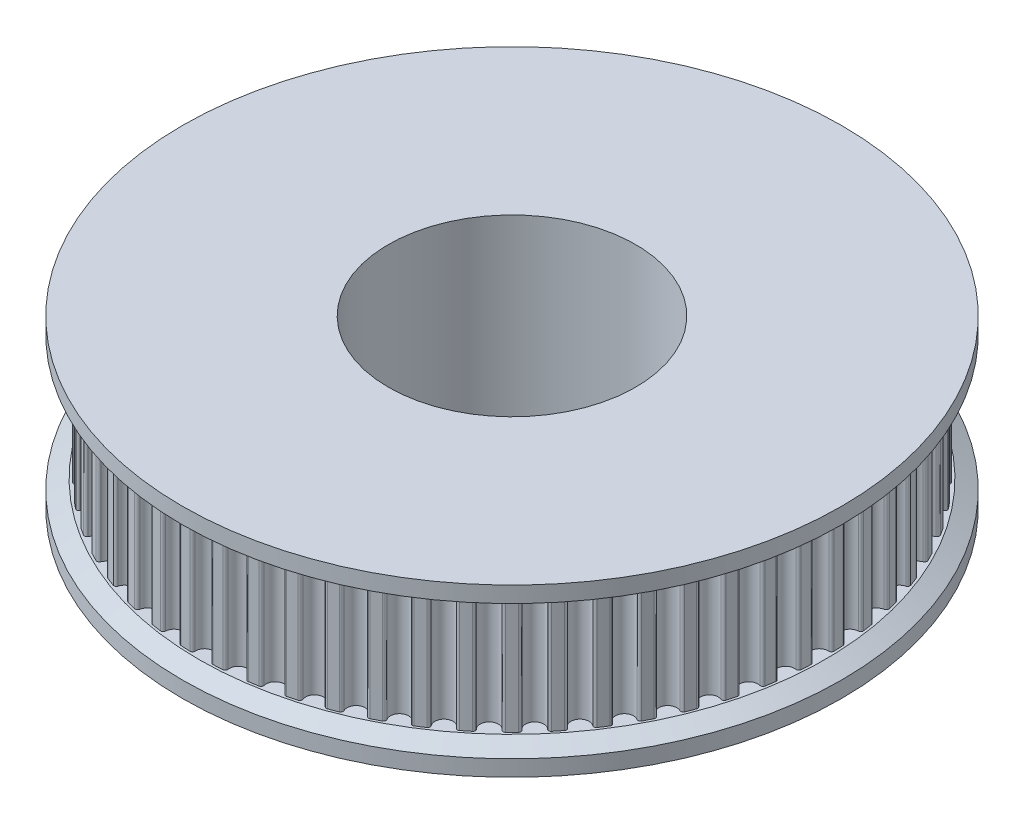
from build123d import *
from OCP.BRepFilletAPI import BRepFilletAPI_MakeChamfer

# Parameters (mm, degrees)
SKETCH_1_R               = 10
SKETCH_1_R_2             = 7.5
EXTRUDE_1_DEPTH          = 7.45
SKETCH_2_R               = 7.5
EXTRUDE_2_DEPTH          = 7
SKETCH_3_R               = 20
SKETCH_3_R_2             = 7.5
EXTRUDE_3_DEPTH          = 1.55
CUT_EXTRUDE_1_REACH      = 34.496
CUT_EXTRUDE_1_END_RADIUS = 10
SKETCH_4_R               = 1.5
EXTRUDE_START            = 1.55
SKETCH_7_R               = 20
SKETCH_7_R_2             = 7.5
EXTRUDE_4_DEPTH          = 1.55
CUT_EXTRUDE_2_REACH      = 34.496
CUT_EXTRUDE_2_END_RADIUS = 10
SKETCH_5_R               = 1.5
CHAMFER_1_SIZE           = 1
CHAMFER_1_SIZE2          = 0.577350269


with BuildPart() as part:
    # Эскиз1 → Бобышка-Вытянуть1 (new body)
    with BuildSketch(Plane(origin=(0, 0, 0), x_dir=(1, 0, 0), z_dir=(0, 1, 0))):
        with Locations(Location((0, 0, 0), (0, 0, 270))):
            Circle(SKETCH_1_R)
        with Locations(Location((0, 0, 0), (0, 0, 270))):
            Circle(SKETCH_1_R_2, mode=Mode.SUBTRACT)
    extrude(amount=EXTRUDE_1_DEPTH)

    # Эскиз2 → Бобышка-Вытянуть2 (add)
    with BuildSketch(Plane(origin=(0, 7.45, 0), x_dir=(1, 0, 0), z_dir=(0, 1, 0))):
        with BuildLine():
            ThreePointArc((1.268212169, 18.807289488), (0.986532775, 18.82416673), (0.704632299, 18.836825458))
            ThreePointArc((0.704632299, 18.836825458), (0.592145975, 18.792176877), (0.549234042, 18.67901666))
            ThreePointArc((0.549234042, 18.67901666), (0, 18.1), (-0.549234042, 18.67901666))
            ThreePointArc((-0.549234042, 18.67901666), (-0.592145975, 18.792176877), (-0.704632299, 18.836825458))
            ThreePointArc((-0.704632299, 18.836825458), (-0.986532775, 18.82416673), (-1.268212169, 18.807289488))
            ThreePointArc((-1.268212169, 18.807289488), (-1.375415233, 18.751127475), (-1.406263626, 18.634101643))
            ThreePointArc((-1.406263626, 18.634101643), (-1.891965185, 18.000846306), (-2.498714188, 18.519280462))
            ThreePointArc((-2.498714188, 18.519280462), (-2.553219508, 18.627335257), (-2.669756667, 18.659981226))
            ThreePointArc((-2.669756667, 18.659981226), (-2.948789666, 18.61792522), (-3.227161838, 18.571696919))
            ThreePointArc((-3.227161838, 18.571696919), (-3.327907104, 18.504636796), (-3.346353976, 18.385027509))
            ThreePointArc((-3.346353976, 18.385027509), (-3.763201604, 17.704471573), (-4.420817898, 18.156643152))
            ThreePointArc((-4.420817898, 18.156643152), (-4.486319434, 18.258408654), (-4.605630623, 18.278694334))
            ThreePointArc((-4.605630623, 18.278694334), (-4.878739, 18.207701826), (-5.150754047, 18.132628953))
            ThreePointArc((-5.150754047, 18.132628953), (-5.243937728, 18.055405444), (-5.249780971, 17.934523166))
            ThreePointArc((-5.249780971, 17.934523166), (-5.593207598, 17.214122945), (-6.294486201, 17.59507786))
            ThreePointArc((-6.294486201, 17.59507786), (-6.370266305, 17.689439105), (-6.491044326, 17.697142243))
            ThreePointArc((-6.491044326, 17.697142243), (-6.755235849, 17.597991039), (-7.017913517, 17.494896109))
            ThreePointArc((-7.017913517, 17.494896109), (-7.102514673, 17.408355292), (-7.095690268, 17.287524434))
            ThreePointArc((-7.095690268, 17.287524434), (-7.36193324, 16.535172783), (-8.099190797, 16.840737213))
            ThreePointArc((-8.099190797, 16.840737213), (-8.184419205, 16.926660359), (-8.305340789, 16.921696558))
            ThreePointArc((-8.305340789, 16.921696558), (-8.55772092, 16.795472981), (-8.808183258, 16.665485522))
            ThreePointArc((-8.808183258, 16.665485522), (-8.883274981, 16.570575556), (-8.863857697, 16.451119967))
            ThreePointArc((-8.863857697, 16.451119967), (-9.05, 15.675059808), (-9.815158964, 15.901885924))
            ThreePointArc((-9.815158964, 15.901885924), (-9.908901896, 15.97842958), (-10.0286422, 15.960853224))
            ThreePointArc((-10.0286422, 15.960853224), (-10.26644581, 15.808940206), (-10.5019487, 15.653484389))
            ThreePointArc((-10.5019487, 15.653484389), (-10.56670827, 15.551245126), (-10.534910846, 15.434473587))
            ThreePointArc((-10.534910846, 15.434473587), (-10.638913066, 14.643207598), (-11.423590195, 14.788810246))
            ThreePointArc((-11.423590195, 14.788810246), (-11.524820584, 14.855135783), (-11.642067708, 14.825139442))
            ThreePointArc((-11.642067708, 14.825139442), (-11.862689371, 14.649201373), (-12.080652594, 14.469980405))
            ThreePointArc((-12.080652594, 14.469980405), (-12.134370491, 14.361532001), (-12.090541307, 14.248723884))
            ThreePointArc((-12.090541307, 14.248723884), (-12.111263975, 13.450921341), (-12.906862181, 13.513705268))
            ThreePointArc((-12.906862181, 13.513705268), (-13.014470926, 13.56908601), (-13.127940287, 13.52699833))
            ThreePointArc((-13.127940287, 13.52699833), (-13.328962825, 13.328962825), (-13.52699833, 13.127940287))
            ThreePointArc((-13.52699833, 13.127940287), (-13.56908601, 13.014470926), (-13.513705268, 12.906862181))
            ThreePointArc((-13.513705268, 12.906862181), (-13.450921341, 12.111263975), (-14.248723884, 12.090541307))
            ThreePointArc((-14.248723884, 12.090541307), (-14.361532001, 12.134370491), (-14.469980405, 12.080652594))
            ThreePointArc((-14.469980405, 12.080652594), (-14.649201373, 11.862689371), (-14.825139442, 11.642067708))
            ThreePointArc((-14.825139442, 11.642067708), (-14.855135783, 11.524820584), (-14.788810246, 11.423590195))
            ThreePointArc((-14.788810246, 11.423590195), (-14.643207598, 10.638913066), (-15.434473587, 10.534910846))
            ThreePointArc((-15.434473587, 10.534910846), (-15.551245126, 10.56670827), (-15.653484389, 10.5019487))
            ThreePointArc((-15.653484389, 10.5019487), (-15.808940206, 10.26644581), (-15.960853224, 10.0286422))
            ThreePointArc((-15.960853224, 10.0286422), (-15.97842958, 9.908901896), (-15.901885924, 9.815158964))
            ThreePointArc((-15.901885924, 9.815158964), (-15.675059808, 9.05), (-16.451119967, 8.863857697))
            ThreePointArc((-16.451119967, 8.863857697), (-16.570575556, 8.883274981), (-16.665485522, 8.808183258))
            ThreePointArc((-16.665485522, 8.808183258), (-16.795472981, 8.55772092), (-16.921696558, 8.305340789))
            ThreePointArc((-16.921696558, 8.305340789), (-16.926660359, 8.184419205), (-16.840737213, 8.099190797))
            ThreePointArc((-16.840737213, 8.099190797), (-16.535172783, 7.36193324), (-17.287524434, 7.095690268))
            ThreePointArc((-17.287524434, 7.095690268), (-17.408355292, 7.102514673), (-17.494896109, 7.017913517))
            ThreePointArc((-17.494896109, 7.017913517), (-17.597991039, 6.755235849), (-17.697142243, 6.491044326))
            ThreePointArc((-17.697142243, 6.491044326), (-17.689439105, 6.370266305), (-17.59507786, 6.294486201))
            ThreePointArc((-17.59507786, 6.294486201), (-17.214122945, 5.593207598), (-17.934523166, 5.249780971))
            ThreePointArc((-17.934523166, 5.249780971), (-18.055405444, 5.243937728), (-18.132628953, 5.150754047))
            ThreePointArc((-18.132628953, 5.150754047), (-18.207701826, 4.878739), (-18.278694334, 4.605630623))
            ThreePointArc((-18.278694334, 4.605630623), (-18.258408654, 4.486319434), (-18.156643152, 4.420817898))
            ThreePointArc((-18.156643152, 4.420817898), (-17.704471573, 3.763201604), (-18.385027509, 3.346353976))
            ThreePointArc((-18.385027509, 3.346353976), (-18.504636796, 3.327907104), (-18.571696919, 3.227161838))
            ThreePointArc((-18.571696919, 3.227161838), (-18.61792522, 2.948789666), (-18.659981226, 2.669756667))
            ThreePointArc((-18.659981226, 2.669756667), (-18.627335257, 2.553219508), (-18.519280462, 2.498714188))
            ThreePointArc((-18.519280462, 2.498714188), (-18.000846306, 1.891965185), (-18.634101643, 1.406263626))
            ThreePointArc((-18.634101643, 1.406263626), (-18.751127475, 1.375415233), (-18.807289488, 1.268212169))
            ThreePointArc((-18.807289488, 1.268212169), (-18.82416673, 0.986532775), (-18.836825458, 0.704632299))
            ThreePointArc((-18.836825458, 0.704632299), (-18.792176877, 0.592145975), (-18.67901666, 0.549234042))
            ThreePointArc((-18.67901666, 0.549234042), (-18.1, 0), (-18.67901666, -0.549234042))
            ThreePointArc((-18.67901666, -0.549234042), (-18.792176877, -0.592145975), (-18.836825458, -0.704632299))
            ThreePointArc((-18.836825458, -0.704632299), (-18.82416673, -0.986532775), (-18.807289488, -1.268212169))
            ThreePointArc((-18.807289488, -1.268212169), (-18.751127475, -1.375415233), (-18.634101643, -1.406263626))
            ThreePointArc((-18.634101643, -1.406263626), (-18.000846306, -1.891965185), (-18.519280462, -2.498714188))
            ThreePointArc((-18.519280462, -2.498714188), (-18.627335257, -2.553219508), (-18.659981226, -2.669756667))
            ThreePointArc((-18.659981226, -2.669756667), (-18.61792522, -2.948789666), (-18.571696919, -3.227161838))
            ThreePointArc((-18.571696919, -3.227161838), (-18.504636796, -3.327907104), (-18.385027509, -3.346353976))
            ThreePointArc((-18.385027509, -3.346353976), (-17.704471573, -3.763201604), (-18.156643152, -4.420817898))
            ThreePointArc((-18.156643152, -4.420817898), (-18.258408654, -4.486319434), (-18.278694334, -4.605630623))
            ThreePointArc((-18.278694334, -4.605630623), (-18.207701826, -4.878739), (-18.132628953, -5.150754047))
            ThreePointArc((-18.132628953, -5.150754047), (-18.055405444, -5.243937728), (-17.934523166, -5.249780971))
            ThreePointArc((-17.934523166, -5.249780971), (-17.214122945, -5.593207598), (-17.59507786, -6.294486201))
            ThreePointArc((-17.59507786, -6.294486201), (-17.689439105, -6.370266305), (-17.697142243, -6.491044326))
            ThreePointArc((-17.697142243, -6.491044326), (-17.597991039, -6.755235849), (-17.494896109, -7.017913517))
            ThreePointArc((-17.494896109, -7.017913517), (-17.408355292, -7.102514673), (-17.287524434, -7.095690268))
            ThreePointArc((-17.287524434, -7.095690268), (-16.535172783, -7.36193324), (-16.840737213, -8.099190797))
            ThreePointArc((-16.840737213, -8.099190797), (-16.926660359, -8.184419205), (-16.921696558, -8.305340789))
            ThreePointArc((-16.921696558, -8.305340789), (-16.795472981, -8.55772092), (-16.665485522, -8.808183258))
            ThreePointArc((-16.665485522, -8.808183258), (-16.570575556, -8.883274981), (-16.451119967, -8.863857697))
            ThreePointArc((-16.451119967, -8.863857697), (-15.675059808, -9.05), (-15.901885924, -9.815158964))
            ThreePointArc((-15.901885924, -9.815158964), (-15.97842958, -9.908901896), (-15.960853224, -10.0286422))
            ThreePointArc((-15.960853224, -10.0286422), (-15.808940206, -10.26644581), (-15.653484389, -10.5019487))
            ThreePointArc((-15.653484389, -10.5019487), (-15.551245126, -10.56670827), (-15.434473587, -10.534910846))
            ThreePointArc((-15.434473587, -10.534910846), (-14.643207598, -10.638913066), (-14.788810246, -11.423590195))
            ThreePointArc((-14.788810246, -11.423590195), (-14.855135783, -11.524820584), (-14.825139442, -11.642067708))
            ThreePointArc((-14.825139442, -11.642067708), (-14.649201373, -11.862689371), (-14.469980405, -12.080652594))
            ThreePointArc((-14.469980405, -12.080652594), (-14.361532001, -12.134370491), (-14.248723884, -12.090541307))
            ThreePointArc((-14.248723884, -12.090541307), (-13.450921341, -12.111263975), (-13.513705268, -12.906862181))
            ThreePointArc((-13.513705268, -12.906862181), (-13.56908601, -13.014470926), (-13.52699833, -13.127940287))
            ThreePointArc((-13.52699833, -13.127940287), (-13.328962825, -13.328962825), (-13.127940287, -13.52699833))
            ThreePointArc((-13.127940287, -13.52699833), (-13.014470926, -13.56908601), (-12.906862181, -13.513705268))
            ThreePointArc((-12.906862181, -13.513705268), (-12.111263975, -13.450921341), (-12.090541307, -14.248723884))
            ThreePointArc((-12.090541307, -14.248723884), (-12.134370491, -14.361532001), (-12.080652594, -14.469980405))
            ThreePointArc((-12.080652594, -14.469980405), (-11.862689371, -14.649201373), (-11.642067708, -14.825139442))
            ThreePointArc((-11.642067708, -14.825139442), (-11.524820584, -14.855135783), (-11.423590195, -14.788810246))
            ThreePointArc((-11.423590195, -14.788810246), (-10.638913066, -14.643207598), (-10.534910846, -15.434473587))
            ThreePointArc((-10.534910846, -15.434473587), (-10.56670827, -15.551245126), (-10.5019487, -15.653484389))
            ThreePointArc((-10.5019487, -15.653484389), (-10.26644581, -15.808940206), (-10.0286422, -15.960853224))
            ThreePointArc((-10.0286422, -15.960853224), (-9.908901896, -15.97842958), (-9.815158964, -15.901885924))
            ThreePointArc((-9.815158964, -15.901885924), (-9.05, -15.675059808), (-8.863857697, -16.451119967))
            ThreePointArc((-8.863857697, -16.451119967), (-8.883274981, -16.570575556), (-8.808183258, -16.665485522))
            ThreePointArc((-8.808183258, -16.665485522), (-8.55772092, -16.795472981), (-8.305340789, -16.921696558))
            ThreePointArc((-8.305340789, -16.921696558), (-8.184419205, -16.926660359), (-8.099190797, -16.840737213))
            ThreePointArc((-8.099190797, -16.840737213), (-7.36193324, -16.535172783), (-7.095690268, -17.287524434))
            ThreePointArc((-7.095690268, -17.287524434), (-7.102514673, -17.408355292), (-7.017913517, -17.494896109))
            ThreePointArc((-7.017913517, -17.494896109), (-6.755235849, -17.597991039), (-6.491044326, -17.697142243))
            ThreePointArc((-6.491044326, -17.697142243), (-6.370266305, -17.689439105), (-6.294486201, -17.59507786))
            ThreePointArc((-6.294486201, -17.59507786), (-5.593207598, -17.214122945), (-5.249780971, -17.934523166))
            ThreePointArc((-5.249780971, -17.934523166), (-5.243937728, -18.055405444), (-5.150754047, -18.132628953))
            ThreePointArc((-5.150754047, -18.132628953), (-4.878739, -18.207701826), (-4.605630623, -18.278694334))
            ThreePointArc((-4.605630623, -18.278694334), (-4.486319434, -18.258408654), (-4.420817898, -18.156643152))
            ThreePointArc((-4.420817898, -18.156643152), (-3.763201604, -17.704471573), (-3.346353976, -18.385027509))
            ThreePointArc((-3.346353976, -18.385027509), (-3.327907104, -18.504636796), (-3.227161838, -18.571696919))
            ThreePointArc((-3.227161838, -18.571696919), (-2.948789666, -18.61792522), (-2.669756667, -18.659981226))
            ThreePointArc((-2.669756667, -18.659981226), (-2.553219508, -18.627335257), (-2.498714188, -18.519280462))
            ThreePointArc((-2.498714188, -18.519280462), (-1.891965185, -18.000846306), (-1.406263626, -18.634101643))
            ThreePointArc((-1.406263626, -18.634101643), (-1.375415233, -18.751127475), (-1.268212169, -18.807289488))
            ThreePointArc((-1.268212169, -18.807289488), (-0.986532775, -18.82416673), (-0.704632299, -18.836825458))
            ThreePointArc((-0.704632299, -18.836825458), (-0.592145975, -18.792176877), (-0.549234042, -18.67901666))
            ThreePointArc((-0.549234042, -18.67901666), (0, -18.1), (0.549234042, -18.67901666))
            ThreePointArc((0.549234042, -18.67901666), (0.592145975, -18.792176877), (0.704632299, -18.836825458))
            ThreePointArc((0.704632299, -18.836825458), (0.986532775, -18.82416673), (1.268212169, -18.807289488))
            ThreePointArc((1.268212169, -18.807289488), (1.375415233, -18.751127475), (1.406263626, -18.634101643))
            ThreePointArc((1.406263626, -18.634101643), (1.891965185, -18.000846306), (2.498714188, -18.519280462))
            ThreePointArc((2.498714188, -18.519280462), (2.553219508, -18.627335257), (2.669756667, -18.659981226))
            ThreePointArc((2.669756667, -18.659981226), (2.948789666, -18.61792522), (3.227161838, -18.571696919))
            ThreePointArc((3.227161838, -18.571696919), (3.327907104, -18.504636796), (3.346353976, -18.385027509))
            ThreePointArc((3.346353976, -18.385027509), (3.763201604, -17.704471573), (4.420817898, -18.156643152))
            ThreePointArc((4.420817898, -18.156643152), (4.486319434, -18.258408654), (4.605630623, -18.278694334))
            ThreePointArc((4.605630623, -18.278694334), (4.878739, -18.207701826), (5.150754047, -18.132628953))
            ThreePointArc((5.150754047, -18.132628953), (5.243937728, -18.055405444), (5.249780971, -17.934523166))
            ThreePointArc((5.249780971, -17.934523166), (5.593207598, -17.214122945), (6.294486201, -17.59507786))
            ThreePointArc((6.294486201, -17.59507786), (6.370266305, -17.689439105), (6.491044326, -17.697142243))
            ThreePointArc((6.491044326, -17.697142243), (6.755235849, -17.597991039), (7.017913517, -17.494896109))
            ThreePointArc((7.017913517, -17.494896109), (7.102514673, -17.408355292), (7.095690268, -17.287524434))
            ThreePointArc((7.095690268, -17.287524434), (7.36193324, -16.535172783), (8.099190797, -16.840737213))
            ThreePointArc((8.099190797, -16.840737213), (8.184419205, -16.926660359), (8.305340789, -16.921696558))
            ThreePointArc((8.305340789, -16.921696558), (8.55772092, -16.795472981), (8.808183258, -16.665485522))
            ThreePointArc((8.808183258, -16.665485522), (8.883274981, -16.570575556), (8.863857697, -16.451119967))
            ThreePointArc((8.863857697, -16.451119967), (9.05, -15.675059808), (9.815158964, -15.901885924))
            ThreePointArc((9.815158964, -15.901885924), (9.908901896, -15.97842958), (10.0286422, -15.960853224))
            ThreePointArc((10.0286422, -15.960853224), (10.26644581, -15.808940206), (10.5019487, -15.653484389))
            ThreePointArc((10.5019487, -15.653484389), (10.56670827, -15.551245126), (10.534910846, -15.434473587))
            ThreePointArc((10.534910846, -15.434473587), (10.638913066, -14.643207598), (11.423590195, -14.788810246))
            ThreePointArc((11.423590195, -14.788810246), (11.524820584, -14.855135783), (11.642067708, -14.825139442))
            ThreePointArc((11.642067708, -14.825139442), (11.862689371, -14.649201373), (12.080652594, -14.469980405))
            ThreePointArc((12.080652594, -14.469980405), (12.134370491, -14.361532001), (12.090541307, -14.248723884))
            ThreePointArc((12.090541307, -14.248723884), (12.111263975, -13.450921341), (12.906862181, -13.513705268))
            ThreePointArc((12.906862181, -13.513705268), (13.014470926, -13.56908601), (13.127940287, -13.52699833))
            ThreePointArc((13.127940287, -13.52699833), (13.328962825, -13.328962825), (13.52699833, -13.127940287))
            ThreePointArc((13.52699833, -13.127940287), (13.56908601, -13.014470926), (13.513705268, -12.906862181))
            ThreePointArc((13.513705268, -12.906862181), (13.450921341, -12.111263975), (14.248723884, -12.090541307))
            ThreePointArc((14.248723884, -12.090541307), (14.361532001, -12.134370491), (14.469980405, -12.080652594))
            ThreePointArc((14.469980405, -12.080652594), (14.649201373, -11.862689371), (14.825139442, -11.642067708))
            ThreePointArc((14.825139442, -11.642067708), (14.855135783, -11.524820584), (14.788810246, -11.423590195))
            ThreePointArc((14.788810246, -11.423590195), (14.643207598, -10.638913066), (15.434473587, -10.534910846))
            ThreePointArc((15.434473587, -10.534910846), (15.551245126, -10.56670827), (15.653484389, -10.5019487))
            ThreePointArc((15.653484389, -10.5019487), (15.808940206, -10.26644581), (15.960853224, -10.0286422))
            ThreePointArc((15.960853224, -10.0286422), (15.97842958, -9.908901896), (15.901885924, -9.815158964))
            ThreePointArc((15.901885924, -9.815158964), (15.675059808, -9.05), (16.451119967, -8.863857697))
            ThreePointArc((16.451119967, -8.863857697), (16.570575556, -8.883274981), (16.665485522, -8.808183258))
            ThreePointArc((16.665485522, -8.808183258), (16.795472981, -8.55772092), (16.921696558, -8.305340789))
            ThreePointArc((16.921696558, -8.305340789), (16.926660359, -8.184419205), (16.840737213, -8.099190797))
            ThreePointArc((16.840737213, -8.099190797), (16.535172783, -7.36193324), (17.287524434, -7.095690268))
            ThreePointArc((17.287524434, -7.095690268), (17.408355292, -7.102514673), (17.494896109, -7.017913517))
            ThreePointArc((17.494896109, -7.017913517), (17.597991039, -6.755235849), (17.697142243, -6.491044326))
            ThreePointArc((17.697142243, -6.491044326), (17.689439105, -6.370266305), (17.59507786, -6.294486201))
            ThreePointArc((17.59507786, -6.294486201), (17.214122945, -5.593207598), (17.934523166, -5.249780971))
            ThreePointArc((17.934523166, -5.249780971), (18.055405444, -5.243937728), (18.132628953, -5.150754047))
            ThreePointArc((18.132628953, -5.150754047), (18.207701826, -4.878739), (18.278694334, -4.605630623))
            ThreePointArc((18.278694334, -4.605630623), (18.258408654, -4.486319434), (18.156643152, -4.420817898))
            ThreePointArc((18.156643152, -4.420817898), (17.704471573, -3.763201604), (18.385027509, -3.346353976))
            ThreePointArc((18.385027509, -3.346353976), (18.504636796, -3.327907104), (18.571696919, -3.227161838))
            ThreePointArc((18.571696919, -3.227161838), (18.61792522, -2.948789666), (18.659981226, -2.669756667))
            ThreePointArc((18.659981226, -2.669756667), (18.627335257, -2.553219508), (18.519280462, -2.498714188))
            ThreePointArc((18.519280462, -2.498714188), (18.000846306, -1.891965185), (18.634101643, -1.406263626))
            ThreePointArc((18.634101643, -1.406263626), (18.751127475, -1.375415233), (18.807289488, -1.268212169))
            ThreePointArc((18.807289488, -1.268212169), (18.82416673, -0.986532775), (18.836825458, -0.704632299))
            ThreePointArc((18.836825458, -0.704632299), (18.792176877, -0.592145975), (18.67901666, -0.549234042))
            ThreePointArc((18.67901666, -0.549234042), (18.1, 0), (18.67901666, 0.549234042))
            ThreePointArc((18.67901666, 0.549234042), (18.792176877, 0.592145975), (18.836825458, 0.704632299))
            ThreePointArc((18.836825458, 0.704632299), (18.82416673, 0.986532775), (18.807289488, 1.268212169))
            ThreePointArc((18.807289488, 1.268212169), (18.751127475, 1.375415233), (18.634101643, 1.406263626))
            ThreePointArc((18.634101643, 1.406263626), (18.000846306, 1.891965185), (18.519280462, 2.498714188))
            ThreePointArc((18.519280462, 2.498714188), (18.627335257, 2.553219508), (18.659981226, 2.669756667))
            ThreePointArc((18.659981226, 2.669756667), (18.61792522, 2.948789666), (18.571696919, 3.227161838))
            ThreePointArc((18.571696919, 3.227161838), (18.504636796, 3.327907104), (18.385027509, 3.346353976))
            ThreePointArc((18.385027509, 3.346353976), (17.704471573, 3.763201604), (18.156643152, 4.420817898))
            ThreePointArc((18.156643152, 4.420817898), (18.258408654, 4.486319434), (18.278694334, 4.605630623))
            ThreePointArc((18.278694334, 4.605630623), (18.207701826, 4.878739), (18.132628953, 5.150754047))
            ThreePointArc((18.132628953, 5.150754047), (18.055405444, 5.243937728), (17.934523166, 5.249780971))
            ThreePointArc((17.934523166, 5.249780971), (17.214122945, 5.593207598), (17.59507786, 6.294486201))
            ThreePointArc((17.59507786, 6.294486201), (17.689439105, 6.370266305), (17.697142243, 6.491044326))
            ThreePointArc((17.697142243, 6.491044326), (17.597991039, 6.755235849), (17.494896109, 7.017913517))
            ThreePointArc((17.494896109, 7.017913517), (17.408355292, 7.102514673), (17.287524434, 7.095690268))
            ThreePointArc((17.287524434, 7.095690268), (16.535172783, 7.36193324), (16.840737213, 8.099190797))
            ThreePointArc((16.840737213, 8.099190797), (16.926660359, 8.184419205), (16.921696558, 8.305340789))
            ThreePointArc((16.921696558, 8.305340789), (16.795472981, 8.55772092), (16.665485522, 8.808183258))
            ThreePointArc((16.665485522, 8.808183258), (16.570575556, 8.883274981), (16.451119967, 8.863857697))
            ThreePointArc((16.451119967, 8.863857697), (15.675059808, 9.05), (15.901885924, 9.815158964))
            ThreePointArc((15.901885924, 9.815158964), (15.97842958, 9.908901896), (15.960853224, 10.0286422))
            ThreePointArc((15.960853224, 10.0286422), (15.808940206, 10.26644581), (15.653484389, 10.5019487))
            ThreePointArc((15.653484389, 10.5019487), (15.551245126, 10.56670827), (15.434473587, 10.534910846))
            ThreePointArc((15.434473587, 10.534910846), (14.643207598, 10.638913066), (14.788810246, 11.423590195))
            ThreePointArc((14.788810246, 11.423590195), (14.855135783, 11.524820584), (14.825139442, 11.642067708))
            ThreePointArc((14.825139442, 11.642067708), (14.649201373, 11.862689371), (14.469980405, 12.080652594))
            ThreePointArc((14.469980405, 12.080652594), (14.361532001, 12.134370491), (14.248723884, 12.090541307))
            ThreePointArc((14.248723884, 12.090541307), (13.450921341, 12.111263975), (13.513705268, 12.906862181))
            ThreePointArc((13.513705268, 12.906862181), (13.56908601, 13.014470926), (13.52699833, 13.127940287))
            ThreePointArc((13.52699833, 13.127940287), (13.328962825, 13.328962825), (13.127940287, 13.52699833))
            ThreePointArc((13.127940287, 13.52699833), (13.014470926, 13.56908601), (12.906862181, 13.513705268))
            ThreePointArc((12.906862181, 13.513705268), (12.111263975, 13.450921341), (12.090541307, 14.248723884))
            ThreePointArc((12.090541307, 14.248723884), (12.134370491, 14.361532001), (12.080652594, 14.469980405))
            ThreePointArc((12.080652594, 14.469980405), (11.862689371, 14.649201373), (11.642067708, 14.825139442))
            ThreePointArc((11.642067708, 14.825139442), (11.524820584, 14.855135783), (11.423590195, 14.788810246))
            ThreePointArc((11.423590195, 14.788810246), (10.638913066, 14.643207598), (10.534910846, 15.434473587))
            ThreePointArc((10.534910846, 15.434473587), (10.56670827, 15.551245126), (10.5019487, 15.653484389))
            ThreePointArc((10.5019487, 15.653484389), (10.26644581, 15.808940206), (10.0286422, 15.960853224))
            ThreePointArc((10.0286422, 15.960853224), (9.908901896, 15.97842958), (9.815158964, 15.901885924))
            ThreePointArc((9.815158964, 15.901885924), (9.05, 15.675059808), (8.863857697, 16.451119967))
            ThreePointArc((8.863857697, 16.451119967), (8.883274981, 16.570575556), (8.808183258, 16.665485522))
            ThreePointArc((8.808183258, 16.665485522), (8.55772092, 16.795472981), (8.305340789, 16.921696558))
            ThreePointArc((8.305340789, 16.921696558), (8.184419205, 16.926660359), (8.099190797, 16.840737213))
            ThreePointArc((8.099190797, 16.840737213), (7.36193324, 16.535172783), (7.095690268, 17.287524434))
            ThreePointArc((7.095690268, 17.287524434), (7.102514673, 17.408355292), (7.017913517, 17.494896109))
            ThreePointArc((7.017913517, 17.494896109), (6.755235849, 17.597991039), (6.491044326, 17.697142243))
            ThreePointArc((6.491044326, 17.697142243), (6.370266305, 17.689439105), (6.294486201, 17.59507786))
            ThreePointArc((6.294486201, 17.59507786), (5.593207598, 17.214122945), (5.249780971, 17.934523166))
            ThreePointArc((5.249780971, 17.934523166), (5.243937728, 18.055405444), (5.150754047, 18.132628953))
            ThreePointArc((5.150754047, 18.132628953), (4.878739, 18.207701826), (4.605630623, 18.278694334))
            ThreePointArc((4.605630623, 18.278694334), (4.486319434, 18.258408654), (4.420817898, 18.156643152))
            ThreePointArc((4.420817898, 18.156643152), (3.763201604, 17.704471573), (3.346353976, 18.385027509))
            ThreePointArc((3.346353976, 18.385027509), (3.327907104, 18.504636796), (3.227161838, 18.571696919))
            ThreePointArc((3.227161838, 18.571696919), (2.948789666, 18.61792522), (2.669756667, 18.659981226))
            ThreePointArc((2.669756667, 18.659981226), (2.553219508, 18.627335257), (2.498714188, 18.519280462))
            ThreePointArc((2.498714188, 18.519280462), (1.891965185, 18.000846306), (1.406263626, 18.634101643))
            ThreePointArc((1.406263626, 18.634101643), (1.375415233, 18.751127475), (1.268212169, 18.807289488))
        make_face()
        with Locations(Location((0, 0, 0), (0, 0, 270))):
            Circle(SKETCH_2_R, mode=Mode.SUBTRACT)
    extrude(amount=EXTRUDE_2_DEPTH)

    # Эскиз3 → Бобышка-Вытянуть3 (add)
    with BuildSketch(Plane(origin=(0, 14.45, 0), x_dir=(1, 0, 0), z_dir=(0, 1, 0))):
        with Locations(Location((0, 0, 0), (0, 0, 90))):
            Circle(SKETCH_3_R)
        with Locations(Location((0, 0, 0), (0, 0, 270))):
            Circle(SKETCH_3_R_2, mode=Mode.SUBTRACT)
    extrude(amount=EXTRUDE_3_DEPTH)

    # Вырез-Вытянуть1: up to this cylinder (the profile starts inside it)
    cut_extrude_1_end = Plane(origin=(0, 3.725, 0), z_dir=(0, -1, 0)) * Cylinder(CUT_EXTRUDE_1_END_RADIUS, 89.992, mode=Mode.PRIVATE)
    # Эскиз4 → Вырез-Вытянуть1 (cut, up to the surface)
    with BuildSketch(Plane.XY, mode=Mode.PRIVATE) as cut_extrude_1_sk1:
        with Locations(Location((0, 3.725, 0), (0, 0, 180))):
            Circle(SKETCH_4_R)
    cut_extrude_1_tool1 = extrude(cut_extrude_1_sk1.sketch, amount=CUT_EXTRUDE_1_REACH, mode=Mode.PRIVATE) & cut_extrude_1_end
    add(cut_extrude_1_tool1.solids().sort_by_distance((0, 3.725, 0))[0], mode=Mode.SUBTRACT)

    # Эскиз7 → Бобышка-Вытянуть4 (add)
    with BuildSketch(Plane.XZ.offset(-7.45).offset(EXTRUDE_START)):
        with Locations(Location((0, 0, 0), (0, 0, 270))):
            Circle(SKETCH_7_R)
        with Locations(Location((0, 0, 0), (0, 0, 90))):
            Circle(SKETCH_7_R_2, mode=Mode.SUBTRACT)
    extrude(amount=-EXTRUDE_4_DEPTH)

    # Вырез-Вытянуть2: up to this cylinder (the profile starts inside it)
    cut_extrude_2_end = Plane(origin=(0, 2.95, 0), z_dir=(0, -1, 0)) * Cylinder(CUT_EXTRUDE_2_END_RADIUS, 89.992, mode=Mode.PRIVATE)
    # Эскиз5 → Вырез-Вытянуть2 (cut, up to the surface)
    with BuildSketch(Plane(origin=(0, 0, 0), x_dir=(0, 0, -1), z_dir=(1, 0, 0)), mode=Mode.PRIVATE) as cut_extrude_2_sk1:
        with Locations(Location((0, 2.95, 0), (0, 0, 180))):
            Circle(SKETCH_5_R)
    cut_extrude_2_tool1 = extrude(cut_extrude_2_sk1.sketch, amount=CUT_EXTRUDE_2_REACH, mode=Mode.PRIVATE) & cut_extrude_2_end
    add(cut_extrude_2_tool1.solids().sort_by_distance((0, 2.95, 0))[0], mode=Mode.SUBTRACT)

    # Фаска1: one chamfer whose edges measure the first distance from different faces: ONE call of the kernel's chamfer builder (chamfer() names one face for all edges)
    chamfer_1_edges_1 = [part.edges().sort_by_distance(p)[0] for p in [
        (0, 14.45, 20),
    ]]
    chamfer_1_side_1 = [part.faces().sort_by_distance(p)[0] for p in [
        (0, 14.45, 19.434314575),
    ]]
    chamfer_1_edges_2 = [part.edges().sort_by_distance(p)[0] for p in [
        (0, 7.45, 20),
    ]]
    chamfer_1_side_2 = [part.faces().sort_by_distance(p)[0] for p in [
        (0, 7.45, 19.434314575),
    ]]
    chamfer_1 = BRepFilletAPI_MakeChamfer(part.part.solid().wrapped)
    for e in chamfer_1_edges_1:
        chamfer_1.Add(CHAMFER_1_SIZE, CHAMFER_1_SIZE2, e.wrapped, chamfer_1_side_1[0].wrapped)  # the first distance lies on this face
    for e in chamfer_1_edges_2:
        chamfer_1.Add(CHAMFER_1_SIZE, CHAMFER_1_SIZE2, e.wrapped, chamfer_1_side_2[0].wrapped)  # the first distance lies on this face
    add(Compound.cast(chamfer_1.Shape()), mode=Mode.REPLACE)


solid = part.part
